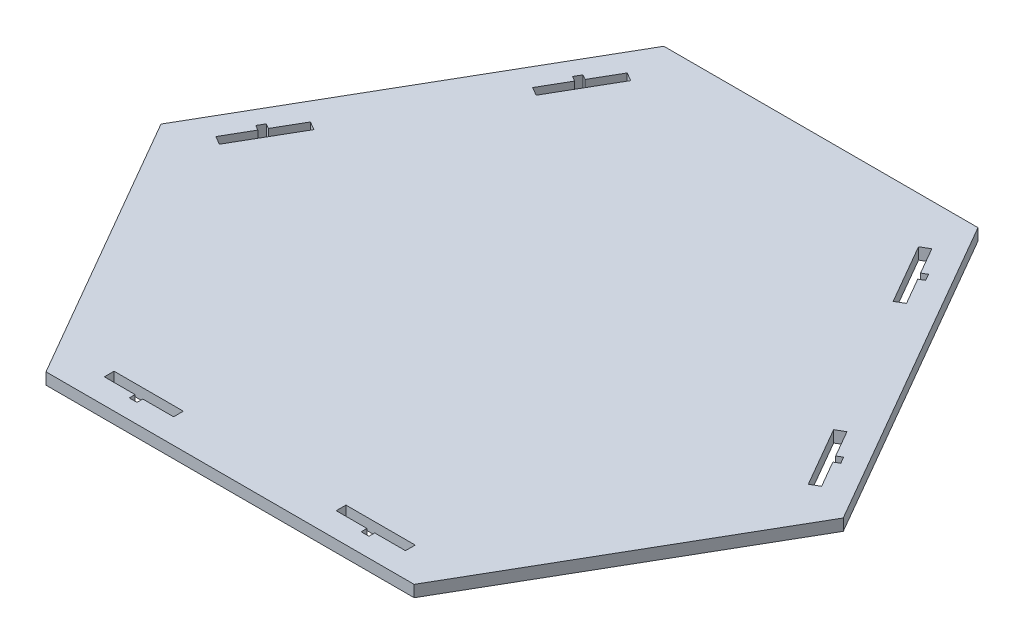
from build123d import *

# Parameters (mm, degrees)
BOSS_EXTRUDE1_DEPTH      = 3
CUT_EXTRUDE1_DEPTH       = 119.131597452
CIRPATTERN1_COUNT        = 3
CIRPATTERN1_COPY_1_DEPTH = 119.131597452
CIRPATTERN1_COPY_2_DEPTH = 119.131597452


with BuildPart() as part:
    # Sketch1 → Boss-Extrude1 (new body)
    with BuildSketch(Plane(origin=(0, 0, 0), x_dir=(1, 0, 0), z_dir=(0, 1, 0))):
        Polygon((-40.640000094, 78.456128134), (40.639999906, 78.456128134), (88.265000282, -4.032791576), (47.624999812, -74.423336558), (-47.625, -74.423336558), (-88.265000094, -4.032791576), align=None)
    extrude(amount=BOSS_EXTRUDE1_DEPTH)

    # Sketch2 → Cut-Extrude1 (cut, through all)
    with BuildSketch(Plane(origin=(0, 3, 0), x_dir=(1, 0, 0), z_dir=(0, 1, 0))):
        Polygon((29, -68), (29, -69.5), (31, -69.5), (31, -68), (38.96, -68), (38.96, -65.48), (21.04, -65.48), (21.04, -68), align=None)
    cut_extrude1 = extrude(amount=-CUT_EXTRUDE1_DEPTH, mode=Mode.SUBTRACT)

    # Mirror1: Cut-Extrude1 across plane
    add(cut_extrude1.mirror(Plane(origin=(0, 0, 0), x_dir=(0, 0, 1), z_dir=(1, 0, 0))), mode=Mode.SUBTRACT)

    # CirPattern1: Cut-Extrude1 ×3 about axis
    cirpattern1_axis = Axis((0, 0, 0), (0, 1, 0))
    for i in range(1, CIRPATTERN1_COUNT):
        add(cut_extrude1.rotate(cirpattern1_axis, i * 360 / CIRPATTERN1_COUNT), mode=Mode.SUBTRACT)

    # CirPattern1 copy 1 sketch → CirPattern1 copy 1 (cut, through all)
    with BuildSketch(Plane(origin=(0, 3, 0), x_dir=(0.4999999999999998, 0, 0.8660254037844387), z_dir=(0, 1, 0))):
        Polygon((29, 68), (29, 69.5), (31, 69.5), (31, 68), (38.96, 68), (38.96, 65.48), (21.04, 65.48), (21.04, 68), align=None)
    extrude(amount=-CIRPATTERN1_COPY_1_DEPTH, mode=Mode.SUBTRACT)

    # CirPattern1 copy 2 sketch → CirPattern1 copy 2 (cut, through all)
    with BuildSketch(Plane(origin=(0, 3, 0), x_dir=(0.5000000000000004, 0, -0.8660254037844384), z_dir=(0, 1, 0))):
        Polygon((29, 68), (29, 69.5), (31, 69.5), (31, 68), (38.96, 68), (38.96, 65.48), (21.04, 65.48), (21.04, 68), align=None)
    extrude(amount=-CIRPATTERN1_COPY_2_DEPTH, mode=Mode.SUBTRACT)


solid = part.part
